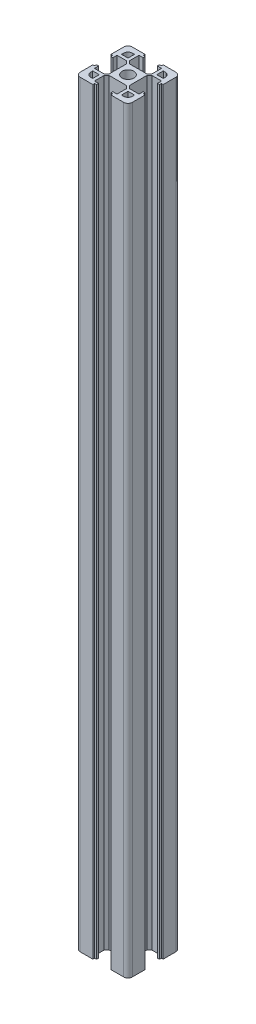
from build123d import *

# Parameters (mm, degrees)
SKETCH_1_R      = 3.4
EXTRUDE_1_DEPTH = 435


with BuildPart() as part:
    # 草图1 → 凸台-拉伸1 (new body)
    with BuildSketch(Plane(origin=(0, 0, 0), x_dir=(1, 0, 0), z_dir=(0, 1, 0))):
        with BuildLine():
            Line((-12.8, 4.1), (-12.8, 6.495575748))
            Line((-12.8, 6.495575748), (-7.273393207, 6.495575748))
            Line((-7.273393207, 6.495575748), (-5.8, 5.022182541))
            Line((-5.8, 5.022182541), (-5.8, 0))
            Line((-5.8, 0), (-5.8, -5.022182541))
            Line((-5.8, -5.022182541), (-7.273393207, -6.495575748))
            Line((-7.273393207, -6.495575748), (-12.8, -6.495575748))
            Line((-12.8, -6.495575748), (-12.8, -4.1))
            Line((-12.8, -4.1), (-14, -4.1))
            Line((-14, -4.1), (-14, -5.2))
            Line((-14, -5.2), (-15, -5.2))
            Line((-15, -5.2), (-15, -12.5))
            ThreePointArc((-15, -12.5), (-14.267766953, -14.267766953), (-12.5, -15))
            Line((-12.5, -15), (-5.2, -15))
            Line((-5.2, -15), (-5.2, -14))
            Line((-5.2, -14), (-4.1, -14))
            Line((-4.1, -14), (-4.1, -12.8))
            Line((-4.1, -12.8), (-6.495575748, -12.8))
            Line((-6.495575748, -12.8), (-6.495575748, -7.273393207))
            Line((-6.495575748, -7.273393207), (-5.022182541, -5.8))
            Line((-5.022182541, -5.8), (0, -5.8))
            Line((0, -5.8), (5.022182541, -5.8))
            Line((5.022182541, -5.8), (6.495575748, -7.273393207))
            Line((6.495575748, -7.273393207), (6.495575748, -12.8))
            Line((6.495575748, -12.8), (4.1, -12.8))
            Line((4.1, -12.8), (4.1, -14))
            Line((4.1, -14), (5.2, -14))
            Line((5.2, -14), (5.2, -15))
            Line((5.2, -15), (12.5, -15))
            ThreePointArc((12.5, -15), (14.267766953, -14.267766953), (15, -12.5))
            Line((15, -12.5), (15, -5.2))
            Line((15, -5.2), (14, -5.2))
            Line((14, -5.2), (14, -4.1))
            Line((14, -4.1), (12.8, -4.1))
            Line((12.8, -4.1), (12.8, -6.495575748))
            Line((12.8, -6.495575748), (7.273393207, -6.495575748))
            Line((7.273393207, -6.495575748), (5.8, -5.022182541))
            Line((5.8, -5.022182541), (5.8, 0))
            Line((5.8, 0), (5.8, 5.022182541))
            Line((5.8, 5.022182541), (7.273393207, 6.495575748))
            Line((7.273393207, 6.495575748), (12.8, 6.495575748))
            Line((12.8, 6.495575748), (12.8, 4.1))
            Line((12.8, 4.1), (14, 4.1))
            Line((14, 4.1), (14, 5.2))
            Line((14, 5.2), (15, 5.2))
            Line((15, 5.2), (15, 12.5))
            ThreePointArc((15, 12.5), (14.267766953, 14.267766953), (12.5, 15))
            Line((12.5, 15), (5.2, 15))
            Line((5.2, 15), (5.2, 14))
            Line((5.2, 14), (4.1, 14))
            Line((4.1, 14), (4.1, 12.8))
            Line((4.1, 12.8), (6.495575748, 12.8))
            Line((6.495575748, 12.8), (6.495575748, 7.273393207))
            Line((6.495575748, 7.273393207), (5.022182541, 5.8))
            Line((5.022182541, 5.8), (0, 5.8))
            Line((0, 5.8), (-5.022182541, 5.8))
            Line((-5.022182541, 5.8), (-6.495575748, 7.273393207))
            Line((-6.495575748, 7.273393207), (-6.495575748, 12.8))
            Line((-6.495575748, 12.8), (-4.1, 12.8))
            Line((-4.1, 12.8), (-4.1, 14))
            Line((-4.1, 14), (-5.2, 14))
            Line((-5.2, 14), (-5.2, 15))
            Line((-5.2, 15), (-12.5, 15))
            ThreePointArc((-12.5, 15), (-14.267766953, 14.267766953), (-15, 12.5))
            Line((-15, 12.5), (-15, 5.2))
            Line((-15, 5.2), (-14, 5.2))
            Line((-14, 5.2), (-14, 4.1))
            Line((-14, 4.1), (-12.8, 4.1))
        make_face()
        with Locations(Location((0, 0, 0), (0, 0, 90))):
            Circle(SKETCH_1_R, mode=Mode.SUBTRACT)
        with BuildLine():
            Line((-12, 9.5), (-12, 8.25))
            Line((-12, 8.25), (-8.25, 8.25))
            Line((-8.25, 8.25), (-8.25, 12))
            Line((-8.25, 12), (-9.5, 12))
            ThreePointArc((-9.5, 12), (-11.267766953, 11.267766953), (-12, 9.5))
        make_face(mode=Mode.SUBTRACT)
        with BuildLine():
            Line((9.5, 12), (8.25, 12))
            Line((8.25, 12), (8.25, 8.25))
            Line((8.25, 8.25), (12, 8.25))
            Line((12, 8.25), (12, 9.5))
            ThreePointArc((12, 9.5), (11.267766953, 11.267766953), (9.5, 12))
        make_face(mode=Mode.SUBTRACT)
        with BuildLine():
            Line((12, -9.5), (12, -8.25))
            Line((12, -8.25), (8.25, -8.25))
            Line((8.25, -8.25), (8.25, -12))
            Line((8.25, -12), (9.5, -12))
            ThreePointArc((9.5, -12), (11.267766953, -11.267766953), (12, -9.5))
        make_face(mode=Mode.SUBTRACT)
        with BuildLine():
            Line((-9.5, -12), (-8.25, -12))
            Line((-8.25, -12), (-8.25, -8.25))
            Line((-8.25, -8.25), (-12, -8.25))
            Line((-12, -8.25), (-12, -9.5))
            ThreePointArc((-12, -9.5), (-11.267766953, -11.267766953), (-9.5, -12))
        make_face(mode=Mode.SUBTRACT)
    extrude(amount=EXTRUDE_1_DEPTH)


solid = part.part
